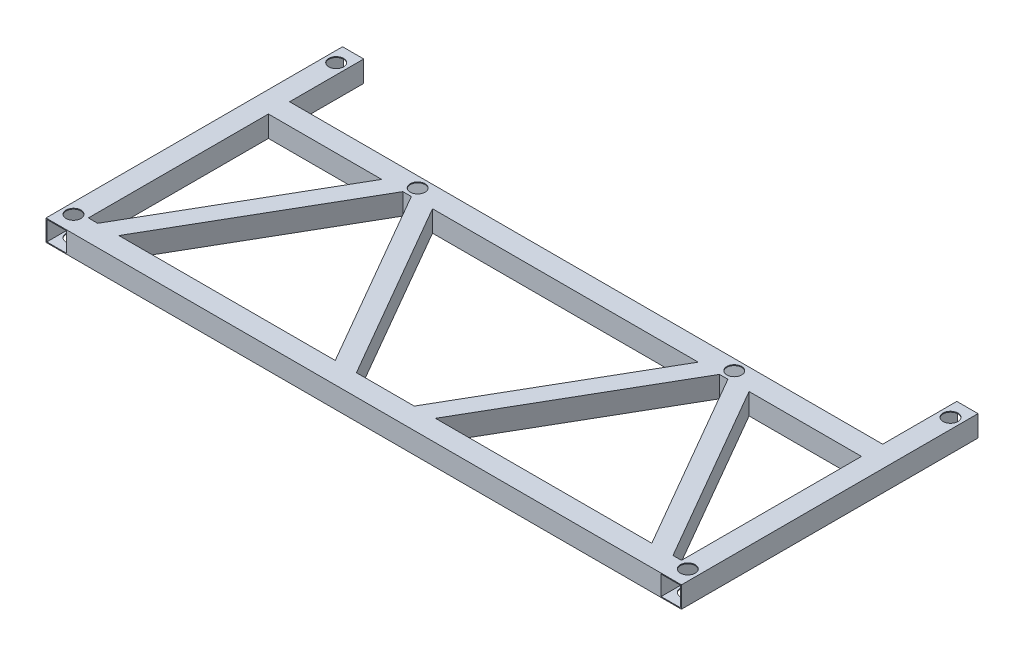
from build123d import *

# Parameters (mm, degrees)
SKETCH1_W           = 50
SKETCH1_H           = 50
SKETCH1_W_2         = 46
SKETCH1_H_2         = 46
EXTRUDE_THIN1_DEPTH = 700
SKETCH2_W           = 50
SKETCH2_H           = 50
SKETCH2_W_2         = 46
SKETCH2_H_2         = 46
BOSS_EXTRUDE1_DEPTH = 1400
SKETCH4_W           = 50
SKETCH4_H           = 50
SKETCH4_W_2         = 46
SKETCH4_H_2         = 46
EXTRUDE_THIN7_DEPTH = 700
SKETCH6_W           = 50
SKETCH6_H           = 50
SKETCH6_W_2         = 46
SKETCH6_H_2         = 46
BOSS_EXTRUDE2_DEPTH = 1400
SKETCH7_W           = 50
SKETCH7_H           = 50
SKETCH11_W          = 50
SKETCH11_H          = 50
LPATTERN1_COUNT     = 2
LPATTERN1_PITCH     = 747.25
SKETCH17_R          = 17.5
CUT_EXTRUDE1_DEPTH  = 1634.439622392
SKETCH18_R          = 17.5
CUT_EXTRUDE2_DEPTH  = 1634.439622392


with BuildPart() as part:
    # Sketch1 → Extrude-Thin1 (new body)
    with BuildSketch(Plane.XY):
        Rectangle(SKETCH1_W, SKETCH1_H)
        Rectangle(SKETCH1_W_2, SKETCH1_H_2, mode=Mode.SUBTRACT)
    extrude(amount=EXTRUDE_THIN1_DEPTH)

    # Sketch2 → Boss-Extrude1 (add)
    with BuildSketch(Plane(origin=(25, 0, 0), x_dir=(0, 0, -1), z_dir=(1, 0, 0))):
        with Locations((-675, 0)):
            Rectangle(SKETCH2_W, SKETCH2_H)
        with Locations((-675, 0)):
            Rectangle(SKETCH2_W_2, SKETCH2_H_2, mode=Mode.SUBTRACT)
    extrude(amount=BOSS_EXTRUDE1_DEPTH)

    # Sketch4 → Extrude-Thin7 (add)
    with BuildSketch(Plane.XY.offset(700)):
        with Locations((1450, 0)):
            Rectangle(SKETCH4_W, SKETCH4_H)
        with Locations((1450, 0)):
            Rectangle(SKETCH4_W_2, SKETCH4_H_2, mode=Mode.SUBTRACT)
    extrude(amount=-EXTRUDE_THIN7_DEPTH)

    # Sketch6 → Boss-Extrude2 (add)
    with BuildSketch(Plane(origin=(25, 0, 0), x_dir=(0, 0, -1), z_dir=(1, 0, 0))):
        with Locations((-200, 0)):
            Rectangle(SKETCH6_W, SKETCH6_H)
        with Locations((-200, 0)):
            Rectangle(SKETCH6_W_2, SKETCH6_H_2, mode=Mode.SUBTRACT)
    extrude(amount=BOSS_EXTRUDE2_DEPTH)

    # Sweep1: sweep along a path in Sketch10
    with BuildLine(Plane(origin=(753.54174377, 0, -435.057528611), x_dir=(0, 1, 0), z_dir=(-0.8660254037844416, 0, 0.49999999999999495))) as sweep1_path:
        Line((-5.323086145, -1252.91651246), (-5.323086145, -750.433692418))
    # Sketch7 → Sweep1 (sweep)
    with BuildSketch(Plane(origin=(0, 0, 650), x_dir=(-1, 0, 0), z_dir=(0, 0, -1))):
        with Locations((-1380, 0)):
            Rectangle(SKETCH7_W, SKETCH7_H)
    sweep1 = sweep(path=sweep1_path.line)

    # Sweep2: sweep along a path in Sketch12
    with BuildLine(Plane(origin=(895.897459622, 0, 517.246639479), x_dir=(0, -1, 0), z_dir=(-0.8660254037844416, 0, -0.49999999999999495))) as sweep2_path:
        Line((0, -337.457351946), (0, 158.99000514))
    # Sketch11 → Sweep2 (sweep)
    with BuildSketch(Plane.XY.offset(225)):
        with Locations((1064.626135594, 0)):
            Rectangle(SKETCH11_W, SKETCH11_H)
    sweep2 = sweep(path=sweep2_path.line)

    # LPattern1: Sweep1, Sweep2 ×2
    with Locations(*[(-i * LPATTERN1_PITCH, 0, 0) for i in range(1, LPATTERN1_COUNT)]):
        add(sweep1)
        add(sweep2)

    # Sketch17 → Cut-Extrude1 (cut, through all)
    with BuildSketch(Plane.XZ.offset(25)):
        with Locations(Location((0, 660, 0), (0, 0, 270))):
            Circle(SKETCH17_R)
        with Locations(Location((0, 40, 0), (0, 0, 270))):
            Circle(SKETCH17_R)
        with Locations(Location((1450, 40, 0), (0, 0, 270))):
            Circle(SKETCH17_R)
        with Locations(Location((1450, 660, 0), (0, 0, 270))):
            Circle(SKETCH17_R)
    extrude(amount=-CUT_EXTRUDE1_DEPTH, mode=Mode.SUBTRACT)

    # Sketch18 → Cut-Extrude2 (cut, through all)
    with BuildSketch(Plane.XZ.offset(25)):
        with Locations(Location((352.376135594, 200, 0), (0, 0, 270))):
            Circle(SKETCH18_R)
        with Locations(Location((1099.626135594, 200, 0), (0, 0, 270))):
            Circle(SKETCH18_R)
    extrude(amount=-CUT_EXTRUDE2_DEPTH, mode=Mode.SUBTRACT)


solid = part.part
